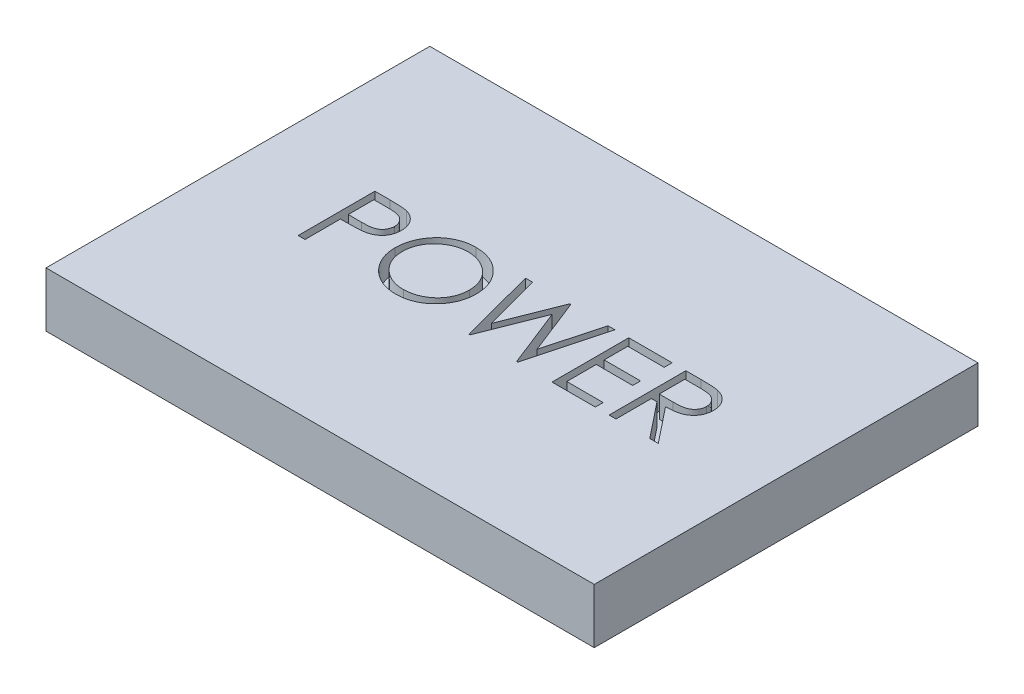
from build123d import *

# Parameters (mm, degrees)
CROQUIS1_W                 = 50
CROQUIS1_H                 = 35
SALIENTE_EXTRUIR1_DEPTH    = 2.5
CORTAR_EXTRUIR1_DEPTH      = 31.923292192
CORTAR_EXTRUIR1_DEPTH_BACK = 2


with BuildPart() as part:
    # Croquis1 → Saliente-Extruir1 (new, symmetric)
    with BuildSketch(Plane(origin=(0, 0, 0), x_dir=(1, 0, 0), z_dir=(0, 1, 0))):
        Rectangle(CROQUIS1_W, CROQUIS1_H)
    extrude(amount=SALIENTE_EXTRUIR1_DEPTH, both=True)

    # Croquis2 → Cortar-Extruir1 (cut, two sides: drawn at the far end of the back side and taken through both)
    # profile 1 of 5: a face of its own
    with BuildSketch(Plane(origin=(0, 2.5, 0), x_dir=(1, 0, 0), z_dir=(0, 1, 0)).offset(-CORTAR_EXTRUIR1_DEPTH_BACK)):
        with BuildLine():
            Line((-16.058408258, 3.554427391), (-14.685611784, 3.554427391))
            add(Edge.make_bspline(
                [(-14.685611784, 3.554427391), (-14.591189972, 3.554323598), (-14.410273586, 3.554124727), (-14.150843475, 3.548095236), (-13.915224011, 3.540041851), (-13.70392325, 3.528878065), (-13.516291053, 3.515684885), (-13.353176454, 3.497180806), (-13.213297342, 3.477860215), (-13.129484443, 3.458217402), (-13.091260823, 3.449259122)],
                knots=[0, 0, 0, 0, 1.415646017, 2.712440637, 3.8905458, 4.950247383, 5.884950622, 6.709939814, 7.411656543, 8, 8, 8, 8], degree=3))
            add(Edge.make_bspline(
                [(-13.091260823, 3.449259122), (-13.042873755, 3.436015222), (-12.947239801, 3.409839498), (-12.809437714, 3.357412052), (-12.678330023, 3.295247721), (-12.553466906, 3.224399841), (-12.43638274, 3.141828713), (-12.325330658, 3.050881478), (-12.221290698, 2.94945834), (-12.124847914, 2.838696861), (-12.036278319, 2.720456441), (-11.960018953, 2.592971981), (-11.896164499, 2.458389374), (-11.841397956, 2.316802232), (-11.801981047, 2.167021585), (-11.772287248, 2.01008816), (-11.753439993, 1.84601878), (-11.751634869, 1.733899045), (-11.750715951, 1.676823224)],
                knots=[0, 0, 0, 0, 0.999701418, 1.975846123, 2.934577507, 3.890451536, 4.834027766, 5.787354733, 6.749476667, 7.726910423, 8.712836071, 9.690891519, 10.682875813, 11.679750201, 12.712814741, 13.765529915, 14.8625177, 16, 16, 16, 16], degree=3))
            add(Edge.make_bspline(
                [(-11.750715951, 1.676823224), (-11.7515588, 1.619267671), (-11.753207892, 1.506656343), (-11.773000463, 1.341910766), (-11.799660846, 1.184473986), (-11.840654951, 1.034695085), (-11.894346297, 0.893463544), (-11.957330403, 0.75862108), (-12.033297463, 0.632461736), (-12.120587123, 0.514527501), (-12.217690311, 0.404707677), (-12.324196188, 0.303798088), (-12.439674773, 0.212389411), (-12.563759069, 0.130276723), (-12.697658767, 0.059364164), (-12.839343074, -0.004150445), (-12.990043507, -0.057492567), (-13.094328535, -0.08555269), (-13.147350566, -0.099819404)],
                knots=[0, 0, 0, 0, 1.121902311, 2.195077645, 3.232258892, 4.234102512, 5.217864754, 6.176164875, 7.132989551, 8.084763148, 9.034132444, 9.988522005, 10.94243251, 11.903244335, 12.886203696, 13.894208494, 14.929344452, 16, 16, 16, 16], degree=3))
            add(Edge.make_bspline(
                [(-13.147350566, -0.099819404), (-13.191205234, -0.109145366), (-13.287315289, -0.129583755), (-13.445600733, -0.152400668), (-13.629891505, -0.17187587), (-13.839936065, -0.186478145), (-14.075545875, -0.198978882), (-14.336848389, -0.208915069), (-14.624356544, -0.214374777), (-14.824899032, -0.214656363), (-14.929602169, -0.214803378)],
                knots=[0, 0, 0, 0, 0.601384939, 1.31797006, 2.144135048, 3.087295005, 4.142315834, 5.309527816, 6.595305764, 8, 8, 8, 8], degree=3))
            Line((-14.929602169, -0.214803378), (-15.43020313, -0.214803378))
            Line((-15.43020313, -0.214803378), (-15.43020313, -3.445572609))
            Line((-15.43020313, -3.445572609), (-16.058408258, -3.445572609))
            Line((-16.058408258, -3.445572609), (-16.058408258, 3.554427391))
        make_face()
        with BuildLine():
            Line((-15.43020313, 2.836478673), (-15.43020313, 0.50314534))
            Line((-15.43020313, 0.50314534), (-14.204642233, 0.48772066))
            add(Edge.make_bspline(
                [(-14.204642233, 0.48772066), (-14.144802381, 0.487689733), (-14.029282781, 0.487630029), (-13.862410335, 0.495600476), (-13.70759176, 0.504801541), (-13.565302609, 0.518273388), (-13.43547874, 0.537315903), (-13.317903683, 0.556539379), (-13.213489117, 0.584350104), (-13.091290713, 0.621796242), (-12.955124018, 0.685661473), (-12.806988921, 0.778361253), (-12.681447749, 0.89652267), (-12.572811155, 1.029378333), (-12.486599399, 1.177176591), (-12.423487415, 1.335314465), (-12.3864051, 1.502170164), (-12.381432713, 1.616346442), (-12.378921079, 1.674018737)],
                knots=[0, 0, 0, 0, 1.160613943, 2.240541288, 3.23993089, 4.169200891, 5.011653406, 5.7853311, 6.478053781, 7.106038997, 8.262395093, 9.384106736, 10.481365981, 11.59014053, 12.70357646, 13.786202915, 14.881775077, 16, 16, 16, 16], degree=3))
            add(Edge.make_bspline(
                [(-12.378921079, 1.674018737), (-12.381446372, 1.730295764), (-12.386466342, 1.842167528), (-12.423778068, 2.006125049), (-12.486476696, 2.162596458), (-12.573389885, 2.308542629), (-12.678872145, 2.440920237), (-12.801470831, 2.555914491), (-12.940897354, 2.648357896), (-13.070593816, 2.70802446), (-13.185796188, 2.744455011), (-13.285860108, 2.769944691), (-13.398841457, 2.790295904), (-13.524777016, 2.80677491), (-13.662690683, 2.820881832), (-13.813767313, 2.830453786), (-13.9774346, 2.836056699), (-14.091055741, 2.836334609), (-14.149954733, 2.836478673)],
                knots=[0, 0, 0, 0, 1.120700087, 2.227813068, 3.331159281, 4.466773991, 5.599788987, 6.693661531, 7.80175334, 8.91857717, 9.525282508, 10.207424825, 10.974604443, 11.810962634, 12.737642355, 13.736264703, 14.826523623, 16, 16, 16, 16], degree=3))
            Line((-14.149954733, 2.836478673), (-15.43020313, 2.836478673))
        make_face(mode=Mode.SUBTRACT)
    # profile 2 of 5: a face of its own
    with BuildSketch(Plane(origin=(0, 2.5, 0), x_dir=(1, 0, 0), z_dir=(0, 1, 0)).offset(-CORTAR_EXTRUIR1_DEPTH_BACK)):
        with BuildLine():
            add(Edge.make_bspline(
                [(-7.039177489, 3.73391457), (-6.909561277, 3.730631612), (-6.654984343, 3.72418361), (-6.280834548, 3.674825403), (-5.923644357, 3.589434623), (-5.58050408, 3.475708658), (-5.255518127, 3.323999887), (-4.946240342, 3.14062959), (-4.653406594, 2.923676673), (-4.380963831, 2.674818219), (-4.13164993, 2.404051311), (-3.911998158, 2.115095491), (-3.72791357, 1.809697886), (-3.576741996, 1.488776225), (-3.458144777, 1.153056289), (-3.376306689, 0.800748284), (-3.324030389, 0.434134904), (-3.317918834, 0.184081174), (-3.314818515, 0.057231878)],
                knots=[0, 0, 0, 0, 1.065120563, 2.091984664, 3.0946048, 4.079830382, 5.057816894, 6.036188127, 7.030412546, 8.04752943, 9.064399622, 10.05169764, 11.02544977, 11.989514704, 12.962713494, 13.945757189, 14.957906945, 16, 16, 16, 16], degree=3))
            add(Edge.make_bspline(
                [(-3.314818515, 0.057231878), (-3.31791838, -0.068683015), (-3.324028573, -0.316875856), (-3.376366128, -0.681162744), (-3.458448128, -1.031344137), (-3.57564066, -1.366835442), (-3.726091617, -1.68799057), (-3.91140196, -1.993964478), (-4.129684381, -2.284857475), (-4.378098083, -2.557482805), (-4.648900167, -2.807477746), (-4.939360701, -3.025315498), (-5.242947341, -3.212763747), (-5.563566757, -3.362331095), (-5.896966831, -3.481874936), (-6.246131477, -3.563380196), (-6.609424585, -3.615954282), (-6.857166592, -3.621991314), (-6.983087746, -3.625059789)],
                knots=[0, 0, 0, 0, 1.043624062, 2.057103931, 3.04512605, 4.022047818, 4.998200453, 5.980619268, 6.982898556, 8.009068085, 9.034988726, 10.034168286, 11.015286542, 11.987931943, 12.962482838, 13.94673481, 14.956375938, 16, 16, 16, 16], degree=3))
            add(Edge.make_bspline(
                [(-6.983087746, -3.625059789), (-7.109936384, -3.621961015), (-7.359988815, -3.615852507), (-7.727062886, -3.563489698), (-8.079618374, -3.48160709), (-8.416647076, -3.364588217), (-8.738336936, -3.213353756), (-9.045317101, -3.028944998), (-9.336355395, -2.810130716), (-9.609038888, -2.561797566), (-9.858537285, -2.291454462), (-10.076056036, -2.001785952), (-10.260506263, -1.698475039), (-10.411232928, -1.380679991), (-10.530561846, -1.049937105), (-10.611971483, -0.70404015), (-10.664643387, -0.344961139), (-10.67071308, -0.100475342), (-10.673792874, 0.023578032)],
                knots=[0, 0, 0, 0, 1.053102029, 2.075944431, 3.073151272, 4.055350789, 5.033113405, 6.020478099, 7.024410459, 8.052272461, 9.079885166, 10.07527673, 11.055994387, 12.023226415, 12.992069828, 13.970394897, 14.97016774, 16, 16, 16, 16], degree=3))
            add(Edge.make_bspline(
                [(-10.673792874, 0.023578032), (-10.672723603, 0.10684337), (-10.67059855, 0.272323617), (-10.645015165, 0.518056817), (-10.607891763, 0.759838133), (-10.554687938, 0.996980029), (-10.485104604, 1.228901998), (-10.403000549, 1.457203524), (-10.302720858, 1.679570971), (-10.189359562, 1.897057755), (-10.062835946, 2.106273567), (-9.923084447, 2.304032733), (-9.77501371, 2.491994726), (-9.612686923, 2.665288734), (-9.441454033, 2.828956047), (-9.258537276, 2.980481481), (-9.065052788, 3.121231383), (-8.860168028, 3.248072065), (-8.648931478, 3.362790334), (-8.431177923, 3.461234036), (-8.20986478, 3.545726159), (-7.983955484, 3.61420781), (-7.75404994, 3.668271882), (-7.519646371, 3.705086589), (-7.280931518, 3.730735225), (-7.12010888, 3.732850229), (-7.039177489, 3.73391457)],
                knots=[0, 0, 0, 0, 1.037015668, 2.060948919, 3.074880161, 4.083647147, 5.086022904, 6.090072063, 7.104153813, 8.122640571, 9.144368836, 10.147691507, 11.138137339, 12.123020368, 13.103399296, 14.087645067, 15.080126199, 16.082011238, 17.087798457, 18.072939717, 19.057185487, 20.037253025, 21.01195951, 21.997135196, 22.992090687, 24, 24, 24, 24], degree=3))
        make_face()
        with BuildLine():
            add(Edge.make_bspline(
                [(-7.00832813, 3.015965852), (-7.074757397, 3.015156072), (-7.206980863, 3.013544252), (-7.403549936, 2.992312821), (-7.597533803, 2.962053043), (-7.788972528, 2.918890002), (-7.977065106, 2.860081896), (-8.163564789, 2.79240008), (-8.346770897, 2.709957899), (-8.526078612, 2.61681249), (-8.699908763, 2.513714648), (-8.863934165, 2.399771114), (-9.018579453, 2.277654006), (-9.163465987, 2.147078331), (-9.298168331, 2.007379127), (-9.425337734, 1.860674255), (-9.539876897, 1.702770473), (-9.644848051, 1.537949659), (-9.738783731, 1.366426497), (-9.822314441, 1.190006772), (-9.890642458, 1.007251399), (-9.946367211, 0.820143084), (-9.992566833, 0.628978164), (-10.021834681, 0.432306467), (-10.0432994, 0.231116243), (-10.044819091, 0.095152535), (-10.045587746, 0.026382519)],
                knots=[0, 0, 0, 0, 1.008559885, 2.007477868, 2.99961109, 3.989939068, 4.984837346, 5.991145699, 7.001802488, 8.033829008, 9.059044045, 10.069351652, 11.065060232, 12.050310815, 13.029377138, 14.011219647, 14.996725999, 15.989392538, 16.977580475, 17.965360261, 18.951710183, 19.937753436, 20.929683414, 21.935841486, 22.955955122, 24, 24, 24, 24], degree=3))
            add(Edge.make_bspline(
                [(-10.045587746, 0.026382519), (-10.043038022, -0.074741923), (-10.038021926, -0.273684983), (-9.994106786, -0.565221271), (-9.926462837, -0.845397844), (-9.826748104, -1.112681662), (-9.702046875, -1.369370228), (-9.547993094, -1.613186437), (-9.365474923, -1.844196186), (-9.15814787, -2.060786724), (-8.931502457, -2.258478332), (-8.690836997, -2.43200515), (-8.438729782, -2.578825649), (-8.174523376, -2.698435794), (-7.899628298, -2.79321527), (-7.612273196, -2.858172532), (-7.314372277, -2.900923443), (-7.111310967, -2.905028954), (-7.00832813, -2.907111071)],
                knots=[0, 0, 0, 0, 1.032063989, 2.030389145, 3.003944642, 3.970395727, 4.937377036, 5.913328081, 6.909231446, 7.93887556, 8.970685674, 9.976071282, 10.964166581, 11.944589148, 12.933237628, 13.927779006, 14.949070134, 16, 16, 16, 16], degree=3))
            add(Edge.make_bspline(
                [(-7.00832813, -2.907111071), (-6.939109127, -2.906160062), (-6.801827054, -2.904273926), (-6.59763601, -2.885276572), (-6.397123586, -2.854812834), (-6.200571026, -2.810951522), (-6.008201404, -2.756057109), (-5.819211797, -2.690841654), (-5.635615217, -2.609479246), (-5.455095541, -2.519583343), (-5.282303058, -2.417103028), (-5.117351993, -2.307026729), (-4.964400033, -2.185089487), (-4.819621891, -2.056453862), (-4.684366513, -1.918526166), (-4.559548544, -1.771485723), (-4.44558828, -1.614404408), (-4.340656987, -1.449833597), (-4.247050461, -1.277841091), (-4.165492263, -1.100781736), (-4.096300031, -0.919091517), (-4.040443022, -0.732508374), (-3.996672098, -0.541386676), (-3.966512258, -0.34547052), (-3.945415381, -0.145151835), (-3.943825227, -0.009664123), (-3.943023643, 0.058634122)],
                knots=[0, 0, 0, 0, 1.047197238, 2.076906641, 3.100256066, 4.114471768, 5.12198147, 6.126382909, 7.136867548, 8.15857795, 9.17633901, 10.174870724, 11.156907918, 12.133735059, 13.104061851, 14.077631395, 15.04955518, 16.038496417, 17.029181396, 18.010275684, 18.986308667, 19.968651475, 20.955262928, 21.950658345, 22.966943676, 24, 24, 24, 24], degree=3))
            add(Edge.make_bspline(
                [(-3.943023643, 0.058634122), (-3.943825869, 0.12646513), (-3.945417232, 0.26102043), (-3.966502181, 0.459942067), (-3.996703962, 0.65444849), (-4.040229378, 0.843776096), (-4.096329685, 1.027973146), (-4.165504346, 1.206866642), (-4.247074945, 1.381123032), (-4.340691394, 1.550311626), (-4.445923041, 1.712661102), (-4.560911528, 1.867865927), (-4.687642224, 2.013011409), (-4.822494274, 2.151680798), (-4.968836044, 2.280916577), (-5.126004632, 2.400761618), (-5.292091988, 2.514108167), (-5.467946459, 2.61635929), (-5.649434366, 2.710787756), (-5.835662282, 2.791689762), (-6.024520481, 2.860434001), (-6.215528706, 2.919067931), (-6.410294663, 2.961883991), (-6.60750232, 2.992340091), (-6.806878838, 3.013536863), (-6.940965277, 3.01515362), (-7.00832813, 3.015965852)],
                knots=[0, 0, 0, 0, 1.02996197, 2.043119294, 3.035359645, 4.018872909, 4.991431989, 5.957985074, 6.929999688, 7.912076566, 8.892894881, 9.867085534, 10.843653904, 11.817741046, 12.803660682, 13.806313499, 14.818574707, 15.856120519, 16.894564902, 17.924820532, 18.937903209, 19.946497019, 20.957711757, 21.963978472, 22.977135795, 24, 24, 24, 24], degree=3))
        make_face(mode=Mode.SUBTRACT)
    # profile 3 of 5: a face of its own
    with BuildSketch(Plane(origin=(0, 2.5, 0), x_dir=(1, 0, 0), z_dir=(0, 1, 0)).offset(-CORTAR_EXTRUIR1_DEPTH_BACK)):
        Polygon((-2.327639028, 3.554427391), (-1.679802489, 3.554427391), (-0.308408258, -1.583393122), (1.727649434, 3.554427391), (1.818795267, 3.554427391), (3.81979687, -1.544130302), (5.196800075, 3.554427391), (5.839027639, 3.554427391), (3.951607767, -3.445572609), (3.861864177, -3.445572609), (1.755694306, 1.905388929), (-0.372911464, -3.445572609), (-0.464057297, -3.445572609), align=None)
    # profile 4 of 5: a face of its own
    with BuildSketch(Plane(origin=(0, 2.5, 0), x_dir=(1, 0, 0), z_dir=(0, 1, 0)).offset(-CORTAR_EXTRUIR1_DEPTH_BACK)):
        Polygon((7.095437895, 3.554427391), (11.044155844, 3.554427391), (11.044155844, 2.836478673), (7.723643024, 2.836478673), (7.723643024, 0.682632519), (11.044155844, 0.682632519), (11.044155844, -0.035316199), (7.723643024, -0.035316199), (7.723643024, -2.727623891), (11.044155844, -2.727623891), (11.044155844, -3.445572609), (7.095437895, -3.445572609), align=None)
    # profile 5 of 5: a face of its own
    with BuildSketch(Plane(origin=(0, 2.5, 0), x_dir=(1, 0, 0), z_dir=(0, 1, 0)).offset(-CORTAR_EXTRUIR1_DEPTH_BACK)):
        with BuildLine():
            Line((12.300566101, 3.554427391), (13.701407447, 3.554427391))
            add(Edge.make_bspline(
                [(13.701407447, 3.554427391), (13.794889704, 3.554116219), (13.974385993, 3.553518734), (14.231532533, 3.550187208), (14.465186727, 3.540638497), (14.675226406, 3.53242133), (14.861647716, 3.517437447), (15.025022297, 3.503116153), (15.164597692, 3.484368832), (15.249089395, 3.466957986), (15.287344947, 3.459074827)],
                knots=[0, 0, 0, 0, 1.410062039, 2.707475311, 3.878576406, 4.937260626, 5.877586885, 6.699081471, 7.410979367, 8, 8, 8, 8], degree=3))
            add(Edge.make_bspline(
                [(15.287344947, 3.459074827), (15.338558195, 3.446421296), (15.439892174, 3.421384169), (15.585792306, 3.368464967), (15.724820954, 3.307225718), (15.856400603, 3.235298277), (15.979872185, 3.152148718), (16.096508807, 3.059212473), (16.206839733, 2.956998061), (16.306402994, 2.842928378), (16.400281097, 2.723255359), (16.47945835, 2.593847845), (16.547711309, 2.45852479), (16.602052343, 2.315909955), (16.64580829, 2.167386411), (16.676660769, 2.011608818), (16.695163144, 1.849286867), (16.697046856, 1.73857105), (16.698001998, 1.682432198)],
                knots=[0, 0, 0, 0, 1.027469482, 2.033020251, 3.019912614, 3.986113645, 4.951240523, 5.91722682, 6.890402269, 7.87763091, 8.8651537, 9.85103654, 10.82876324, 11.815024772, 12.821070561, 13.842952187, 14.906261191, 16, 16, 16, 16], degree=3))
            add(Edge.make_bspline(
                [(16.698001998, 1.682432198), (16.695064002, 1.589161989), (16.68933121, 1.407167653), (16.635881003, 1.143045891), (16.548327963, 0.896667261), (16.427681385, 0.668341986), (16.274042434, 0.462520695), (16.089392852, 0.281739784), (15.873629629, 0.130459959), (15.672770997, 0.02555435), (15.495342597, -0.041631468), (15.349275972, -0.088904185), (15.189942017, -0.125428116), (15.018867348, -0.158148379), (14.835340037, -0.182851768), (14.639799958, -0.200944957), (14.432107655, -0.212253055), (14.289429516, -0.213937064), (14.216030844, -0.214803378)],
                knots=[0, 0, 0, 0, 1.260483769, 2.459530307, 3.627416485, 4.787058657, 5.939039949, 7.08810263, 8.267026773, 9.491475466, 10.141966685, 10.831826277, 11.566392101, 12.351337768, 13.187381173, 14.07005841, 15.007169909, 16, 16, 16, 16], degree=3))
            Line((14.216030844, -0.214803378), (16.787745588, -3.445572609))
            Line((16.787745588, -3.445572609), (16.010902639, -3.445572609))
            Line((16.010902639, -3.445572609), (13.439187895, -0.214803378))
            Line((13.439187895, -0.214803378), (12.928771229, -0.214803378))
            Line((12.928771229, -0.214803378), (12.928771229, -3.445572609))
            Line((12.928771229, -3.445572609), (12.300566101, -3.445572609))
            Line((12.300566101, -3.445572609), (12.300566101, 3.554427391))
        make_face()
        with BuildLine():
            Line((12.928771229, 2.836478673), (12.928771229, 0.50314534))
            Line((12.928771229, 0.50314534), (14.21042187, 0.493329634))
            add(Edge.make_bspline(
                [(14.21042187, 0.493329634), (14.270261948, 0.493303161), (14.386249062, 0.493251848), (14.554050392, 0.501239401), (14.710290615, 0.510326037), (14.854372119, 0.524224728), (14.98635927, 0.542136872), (15.106186096, 0.56454284), (15.2140482, 0.590646966), (15.339845277, 0.631050217), (15.48031834, 0.695062254), (15.632981259, 0.788193251), (15.762985935, 0.905331489), (15.87282166, 1.039278401), (15.961080522, 1.186550899), (16.023304631, 1.345383638), (16.062789516, 1.511766834), (16.067446607, 1.626123049), (16.06979687, 1.683834442)],
                knots=[0, 0, 0, 0, 1.146690395, 2.22261258, 3.21895312, 4.145990853, 4.996080663, 5.770904154, 6.481378293, 7.121626537, 8.300444488, 9.431385265, 10.535395872, 11.636531494, 12.74115979, 13.810798291, 14.895190096, 16, 16, 16, 16], degree=3))
            add(Edge.make_bspline(
                [(16.06979687, 1.683834442), (16.067392628, 1.74012759), (16.062628297, 1.851680067), (16.02373076, 2.014991887), (15.957951997, 2.169125788), (15.869307521, 2.313454758), (15.761309211, 2.444466229), (15.634673586, 2.556560536), (15.492863196, 2.649059465), (15.360320799, 2.708168226), (15.241852374, 2.744407932), (15.138993054, 2.76991026), (15.022770098, 2.790399198), (14.892619181, 2.80681532), (14.74909592, 2.820925208), (14.591474617, 2.830428765), (14.420801057, 2.836056494), (14.302507195, 2.836334671), (14.241271229, 2.836478673)],
                knots=[0, 0, 0, 0, 1.101028733, 2.181837193, 3.264309656, 4.369019818, 5.486613113, 6.575447106, 7.666700264, 8.788928104, 9.402425223, 10.0903467, 10.862060571, 11.710948788, 12.657782767, 13.684531032, 14.801375019, 16, 16, 16, 16], degree=3))
            Line((14.241271229, 2.836478673), (12.928771229, 2.836478673))
        make_face(mode=Mode.SUBTRACT)
    extrude(amount=CORTAR_EXTRUIR1_DEPTH + CORTAR_EXTRUIR1_DEPTH_BACK, mode=Mode.SUBTRACT)


solid = part.part
